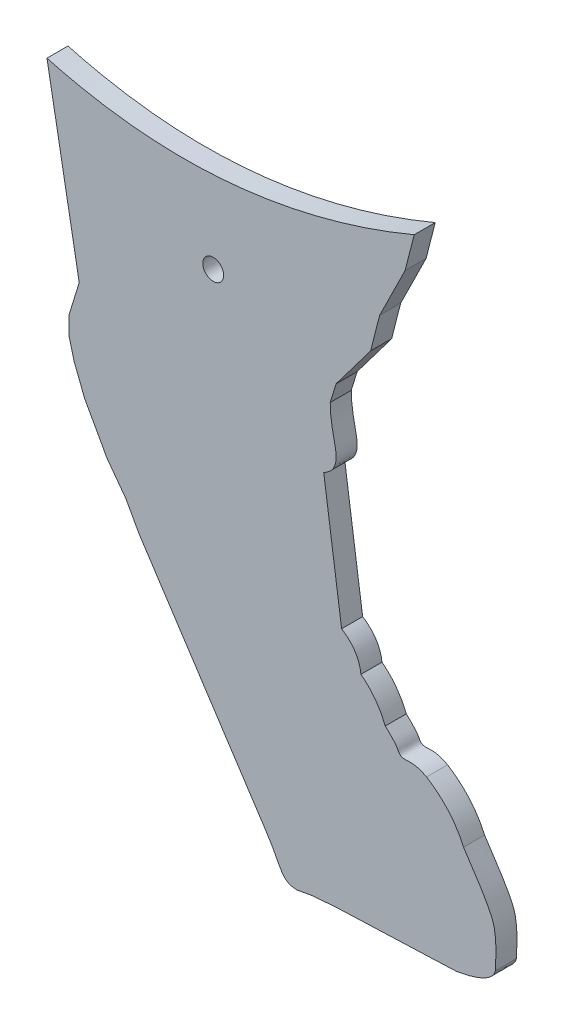
from build123d import *

# Parameters (mm, degrees)
SKETCH1_R           = 1.5748
BOSS_EXTRUDE2_DEPTH = 3.175


with BuildPart() as part:
    # Sketch1 → Boss-Extrude2 (new body)
    with BuildSketch(Plane.XY):
        with BuildLine():
            Line((95.015088918, 73.039622028), (93.442430116, 67.947203051))
            Line((93.442430116, 67.947203051), (93.442430116, 65.400993562))
            Line((93.442430116, 65.400993562), (94.228759517, 62.405452988))
            Line((94.228759517, 62.405452988), (95.838862576, 58.286584697))
            Line((95.838862576, 58.286584697), (97.860852464, 54.617047494))
            Line((97.860852464, 54.617047494), (99.187742953, 52.208986977))
            Line((99.187742953, 52.208986977), (102.054609268, 48.326412287))
            Line((102.054609268, 48.326412287), (104.044945002, 44.714321512))
            Line((104.044945002, 44.714321512), (123.032849585, 15.718572297))
            add(Edge.make_bspline(
                [(123.032849585, 15.718572297), (123.714332191, 14.723172575), (125.027867192, 12.417046111), (126.13133155, 9.993338557), (127.965130812, 10.093714094)],
                knots=[0, 0, 0, 0, 0.482545384, 1, 1, 1, 1], degree=3))
            Line((127.965130812, 10.093714094), (130.045906785, 10.470125175))
            Line((130.045906785, 10.470125175), (133.787640512, 10.774684897))
            Line((133.787640512, 10.774684897), (151.974206763, 11.470821404))
            add(Edge.make_bspline(
                [(157.829388483, 14.502166506), (157.371014603, 12.448651519), (153.413195637, 11.740221824), (151.974206763, 11.470821404)],
                knots=[0, 0, 0, 0, 1, 1, 1, 1], degree=3))
            add(Edge.make_bspline(
                [(153.017246456, 28.246281812), (155.053521845, 25.097258497), (156.168563434, 23.654410632), (158.146330261, 19.312087579), (157.900569474, 15.925786313), (157.829388483, 14.502166506)],
                knots=[0, 0, 0, 0, 0.545638179, 0.593853925, 1, 1, 1, 1], degree=3))
            add(Edge.make_bspline(
                [(147.437307536, 34.637439041), (151.311718476, 32.18181338), (153.017246456, 28.246281812)],
                knots=[0, 0, 0, 1, 1, 1], degree=2))
            add(Edge.make_bspline(
                [(141.208586267, 38.180201711), (142.057807777, 37.336444115), (142.696530206, 36.831682565), (143.864835089, 34.558137065), (144.807852022, 36.057345018), (147.437307536, 34.637439041)],
                knots=[0, 0, 0, 0, 0.387994133, 0.411004513, 1, 1, 1, 1], degree=3))
            add(Edge.make_bspline(
                [(137.536109778, 43.092261061), (139.98410163, 41.245320741), (141.208586267, 38.180201711)],
                knots=[0, 0, 0, 1, 1, 1], degree=2))
            add(Edge.make_bspline(
                [(134.617377974, 47.591397428), (137.229688432, 45.916641925), (137.536109778, 43.092261061)],
                knots=[0, 0, 0, 1, 1, 1], degree=2))
            Line((134.617377974, 47.591397428), (134.513357882, 48.326412287))
            Line((134.513357882, 48.326412287), (131.916773648, 66.674098307))
            add(Edge.make_bspline(
                [(132.897509942, 76.314808247), (132.915948654, 73.197862503), (134.383448092, 69.97548856), (133.38418012, 67.42441049), (131.916773648, 66.674098307)],
                knots=[0, 0, 0, 0, 0.57532368, 1, 1, 1, 1], degree=3))
            Line((132.897509942, 76.314808247), (133.787640512, 79.197135805))
            Line((133.787640512, 79.197135805), (138.995570312, 86.101639813))
            Line((138.995570312, 86.101639813), (140.361296403, 91.450733668))
            Line((140.361296403, 91.450733668), (143.122445567, 97.027448538))
            Line((143.122445567, 97.027448538), (144.200087546, 99.203970593))
            Line((144.200087546, 99.203970593), (145.570696028, 104.572187149))
            add(Edge.make_bspline(
                [(90.14826379, 99.94311483), (116.963000062, 92.578435943), (145.570696028, 104.572187149)],
                knots=[0, 0, 0, 1, 1, 1], degree=2))
            Line((90.14826379, 99.94311483), (92.499806905, 86.943937416))
            Line((92.499806905, 86.943937416), (95.015088918, 73.039622028))
        make_face()
        with Locations((115.239537292, 84.884886181)):
            Circle(SKETCH1_R, mode=Mode.SUBTRACT)
    extrude(amount=BOSS_EXTRUDE2_DEPTH)


solid = part.part
